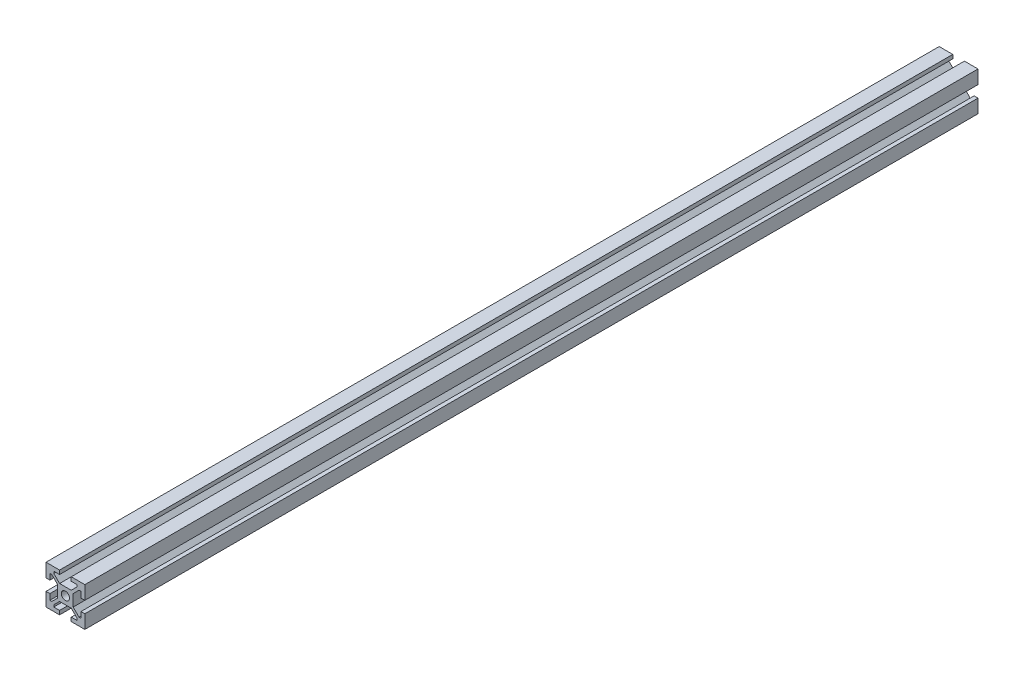
from build123d import *

# Parameters (mm, degrees)
SKETCH_2_R      = 2.1
EXTRUDE_1_DEPTH = 460


with BuildPart() as part:
    # ｽｹｯﾁ2 → ﾎﾞｽ - 押し出し1 (new body)
    with BuildSketch(Plane.XY):
        Polygon((3, 4), (-3, 4), (-6, 7), (-6, 8), (-3, 8), (-3, 10), (-10, 10), (-10, 3), (-8, 3), (-8, 6), (-7, 6), (-4, 3), (-4, -3), (-7, -6), (-8, -6), (-8, -3), (-10, -3), (-10, -10), (-3, -10), (-3, -8), (-6, -8), (-6, -7), (-3, -4), (3, -4), (6, -7), (6, -8), (3, -8), (3, -10), (10, -10), (10, -3), (8, -3), (8, -6), (7, -6), (4, -3), (4, 3), (7, 6), (8, 6), (8, 3), (10, 3), (10, 10), (3, 10), (3, 8), (6, 8), (6, 7), align=None)
        Circle(SKETCH_2_R, mode=Mode.SUBTRACT)
    extrude(amount=EXTRUDE_1_DEPTH)


solid = part.part
